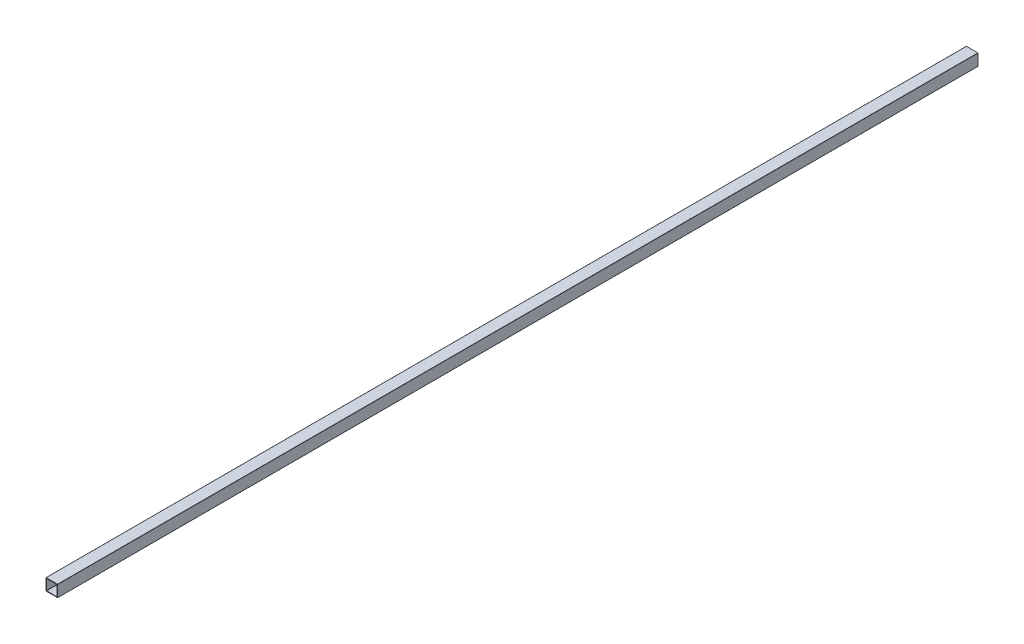
from build123d import *

# Parameters (mm, degrees)
CROQUIS1_W              = 76.2
CROQUIS1_H              = 76.2
CROQUIS1_W_2            = 69.2
CROQUIS1_H_2            = 69.2
SALIENTE_EXTRUIR1_DEPTH = 6000
REDONDEO1_R             = 1


with BuildPart() as part:
    # Croquis1 → Saliente-Extruir1 (new body)
    with BuildSketch(Plane.XY):
        Rectangle(CROQUIS1_W, CROQUIS1_H)
        Rectangle(CROQUIS1_W_2, CROQUIS1_H_2, mode=Mode.SUBTRACT)
    extrude(amount=-SALIENTE_EXTRUIR1_DEPTH)

    # Redondeo1
    redondeo1_edges = [part.edges().sort_by_distance(p)[0] for p in [
        (34.6, -34.6, -3000),
        (-34.6, -34.6, -3000),
        (-34.6, 34.6, -3000),
        (34.6, 34.6, -3000),
        (38.1, -38.1, -3000),
        (-38.1, -38.1, -3000),
        (-38.1, 38.1, -3000),
        (38.1, 38.1, -3000),
    ]]
    fillet(redondeo1_edges, radius=REDONDEO1_R)


solid = part.part
